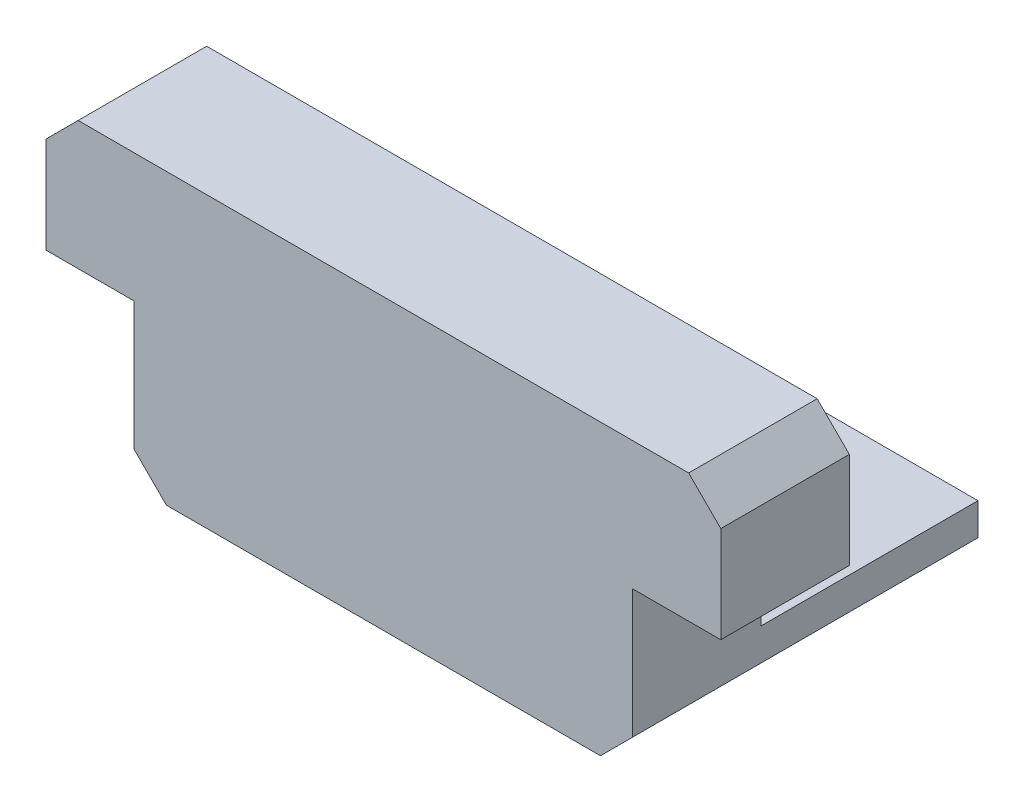
from build123d import *

# Parameters (mm, degrees)
EXTRUDE_1_DEPTH     = 21.5
SKETCH_2_W          = 43.373604633
SKETCH_2_H          = 16.611508938
CUT_EXTRUDE_1_DEPTH = 13.5


with BuildPart() as part:
    # Эскиз1 → Вытянуть1 (new body)
    with BuildSketch(Plane.XY):
        Polygon((-0.0095286, 2), (1.9904714, 0), (29.0095286, 0), (31.0095286, 2), (31.0095286, 10), (36.5, 10), (36.5, 15.9904714), (34.5, 17.9904714), (-3.5, 17.9904714), (-5.5, 15.9904714), (-5.5, 10), (-0.0095286, 10), align=None)
    extrude(amount=EXTRUDE_1_DEPTH)

    # Эскиз2 → Вырез-Вытянуть1 (cut)
    with BuildSketch(Plane(origin=(0, 0, 0), x_dir=(-1, 0, 0), z_dir=(0, 0, -1))):
        with Locations((-15.469303829, 12.305754469)):
            Rectangle(SKETCH_2_W, SKETCH_2_H)
    extrude(amount=-CUT_EXTRUDE_1_DEPTH, mode=Mode.SUBTRACT)


solid = part.part
